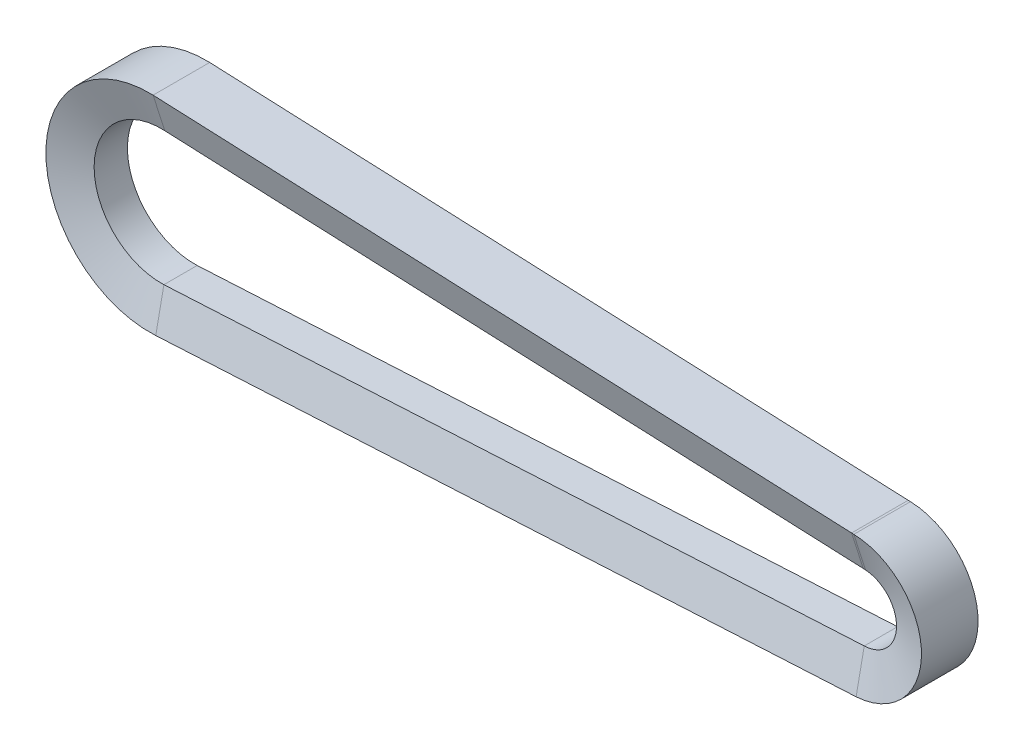
from build123d import *


with BuildPart() as part:
    # Sweep1: sweep along a path in Sketch1
    with BuildLine(Plane.XY) as sweep1_path:
        Line((0.662878519, 15.485819064), (-209.801736466, 24.494866094))
        ThreePointArc((-209.801736466, 24.494866094), (-236.522271536, -1.241155479), (-209.533114838, -26.695334341))
        Line((-209.533114838, -26.695334341), (0.825361845, -15.478009492))
        ThreePointArc((0.825361845, -15.478009492), (15.499786597, 0.081335449), (0.662878519, 15.485819064))
    # Sketch2 → Sweep1 (sweep)
    with BuildSketch(Plane(origin=(0, 0, 0), x_dir=(0, 0, -1), z_dir=(1, 0, 0))):
        Polygon((8.5, 21), (-8.5, 21), (-5, 10), (5, 10), align=None)
    sweep(path=sweep1_path.line)


solid = part.part
